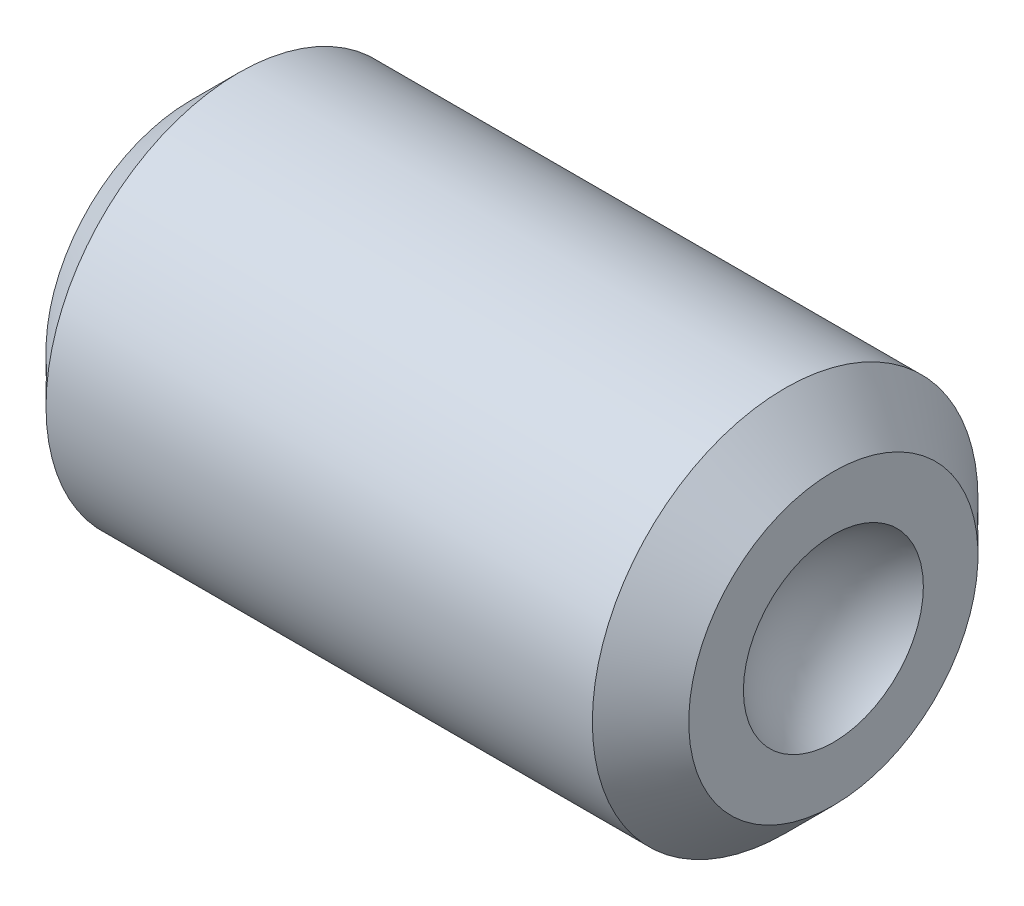
from build123d import *

# Parameters (mm, degrees)
CUT_EXTRUDE1_DEPTH = 3


with BuildPart() as part:
    # Sketch1 → Revolve1 (revolve)
    with BuildSketch(Plane.XY, mode=Mode.PRIVATE) as revolve1_sk:
        with BuildLine():
            Line((0, 0), (0, 1.125))
            Line((0, 1.125), (0.375, 1.5))
            Line((0.375, 1.5), (4.625, 1.5))
            Line((4.625, 1.5), (5, 1.125))
            Line((5, 1.125), (5, 0.7))
            ThreePointArc((5, 0.7), (4.724655592, 0.397059504), (4.625, 0))
            Line((4.625, 0), (0, 0))
        make_face()
    revolve(revolve1_sk.sketch.rotate(Axis((0, 0, 0), (1, 0, 0)), 180), axis=Axis((0, 0, 0), (1, 0, 0)))

    # Sketch2 → Cut-Extrude1 (cut)
    with BuildSketch(Plane.ZY):
        Polygon((0, 0.866025404), (-0.75, 0.433012702), (-0.75, -0.433012702), (0, -0.866025404), (0.75, -0.433012702), (0.75, 0.433012702), align=None)
    extrude(amount=-CUT_EXTRUDE1_DEPTH, mode=Mode.SUBTRACT)


solid = part.part
